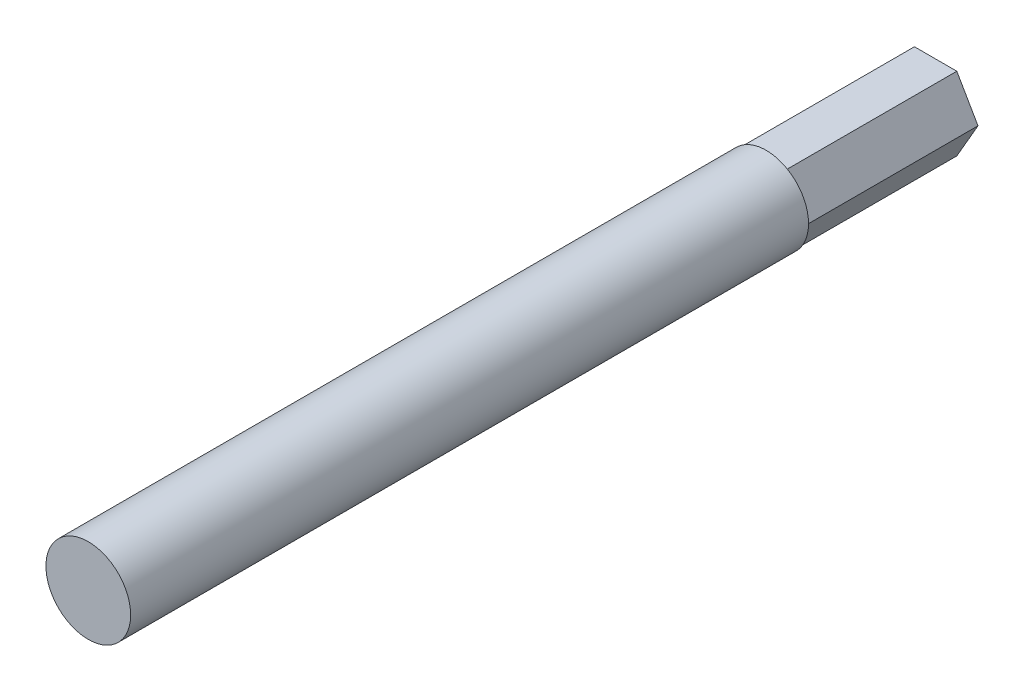
from build123d import *

# Parameters (mm, degrees)
BOSS_EXTRUDE1_DEPTH      = 63.5
BOSS_EXTRUDE1_DEPTH_BACK = 63.5
SKETCH1_R                = 6.35
CUT_EXTRUDE1_DEPTH       = 25.4


with BuildPart() as part:
    # Sketch1 → Boss-Extrude1 (new, two sides: drawn at the far end of the back side and taken through both)
    with BuildSketch(Plane.XY.offset(-BOSS_EXTRUDE1_DEPTH_BACK)):
        Circle(SKETCH1_R)
    extrude(amount=BOSS_EXTRUDE1_DEPTH + BOSS_EXTRUDE1_DEPTH_BACK)

    # Sketch2 → Cut-Extrude1 (cut)
    with BuildSketch(Plane(origin=(0, 0, -63.5), x_dir=(-1, 0, 0), z_dir=(0, 0, -1))):
        with BuildLine():
            ThreePointArc((6.35, 0), (5.499261314, 3.175), (3.175, 5.499261314))
            Line((3.175, 5.499261314), (6.35, 0))
        make_face()
        with BuildLine():
            Line((-3.175, 5.499261314), (3.175, 5.499261314))
            ThreePointArc((3.175, 5.499261314), (0, 6.35), (-3.175, 5.499261314))
        make_face()
        with BuildLine():
            Line((-6.35, 0), (-3.175, 5.499261314))
            ThreePointArc((-3.175, 5.499261314), (-5.499261314, 3.175), (-6.35, 0))
        make_face()
        with BuildLine():
            ThreePointArc((3.175, -5.499261314), (5.499261314, -3.175), (6.35, 0))
            Line((6.35, 0), (3.175, -5.499261314))
        make_face()
        with BuildLine():
            Line((-3.175, -5.499261314), (-6.35, 0))
            ThreePointArc((-6.35, 0), (-5.499261314, -3.175), (-3.175, -5.499261314))
        make_face()
        with BuildLine():
            ThreePointArc((-3.175, -5.499261314), (0, -6.35), (3.175, -5.499261314))
            Line((3.175, -5.499261314), (-3.175, -5.499261314))
        make_face()
    extrude(amount=-CUT_EXTRUDE1_DEPTH, mode=Mode.SUBTRACT)


solid = part.part
